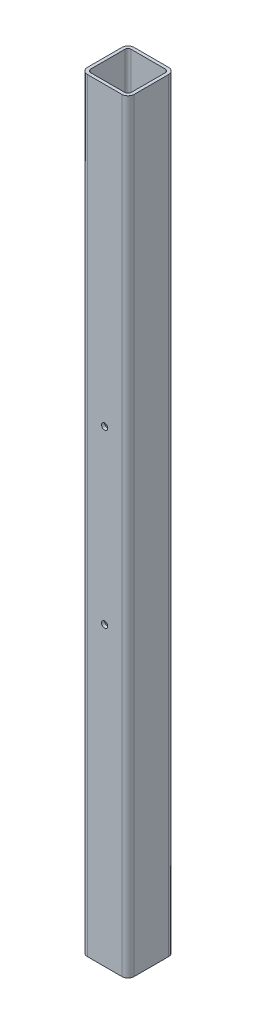
from build123d import *

# Parameters (mm, degrees)
EXTRUDE_1_DEPTH          = 245
CUT_EXTRUDE_1_DEPTH      = 246.916652547
CUT_EXTRUDE_1_DEPTH_BACK = 246.916652547
SKETCH_2_R               = 2


with BuildPart() as part:
    # 草图1 → 凸台-拉伸1 (new, symmetric)
    with BuildSketch(Plane(origin=(0, 0, 0), x_dir=(1, 0, 0), z_dir=(0, 1, 0))):
        with BuildLine():
            Line((-11, -15), (11, -15))
            ThreePointArc((11, -15), (13.828427125, -13.828427125), (15, -11))
            Line((15, -11), (15, 11))
            ThreePointArc((15, 11), (13.828427125, 13.828427125), (11, 15))
            Line((11, 15), (-11, 15))
            ThreePointArc((-11, 15), (-13.828427125, 13.828427125), (-15, 11))
            Line((-15, 11), (-15, -11))
            ThreePointArc((-15, -11), (-13.828427125, -13.828427125), (-11, -15))
        make_face()
        with BuildLine():
            Line((-11, -13), (11, -13))
            ThreePointArc((11, -13), (12.414213562, -12.414213562), (13, -11))
            Line((13, -11), (13, 11))
            ThreePointArc((13, 11), (12.414213562, 12.414213562), (11, 13))
            Line((11, 13), (-11, 13))
            ThreePointArc((-11, 13), (-12.414213562, 12.414213562), (-13, 11))
            Line((-13, 11), (-13, -11))
            ThreePointArc((-13, -11), (-12.414213562, -12.414213562), (-11, -13))
        make_face(mode=Mode.SUBTRACT)
    extrude(amount=EXTRUDE_1_DEPTH, both=True)

    # 草图2 → 切除-拉伸1 (cut, two sides: drawn at the far end of the back side and taken through both)
    with BuildSketch(Plane.XY.offset(-CUT_EXTRUDE_1_DEPTH_BACK)):
        with Locations((0, 55)):
            Circle(SKETCH_2_R)
        with Locations((0, -55)):
            Circle(SKETCH_2_R)
    extrude(amount=CUT_EXTRUDE_1_DEPTH + CUT_EXTRUDE_1_DEPTH_BACK, mode=Mode.SUBTRACT)


solid = part.part
